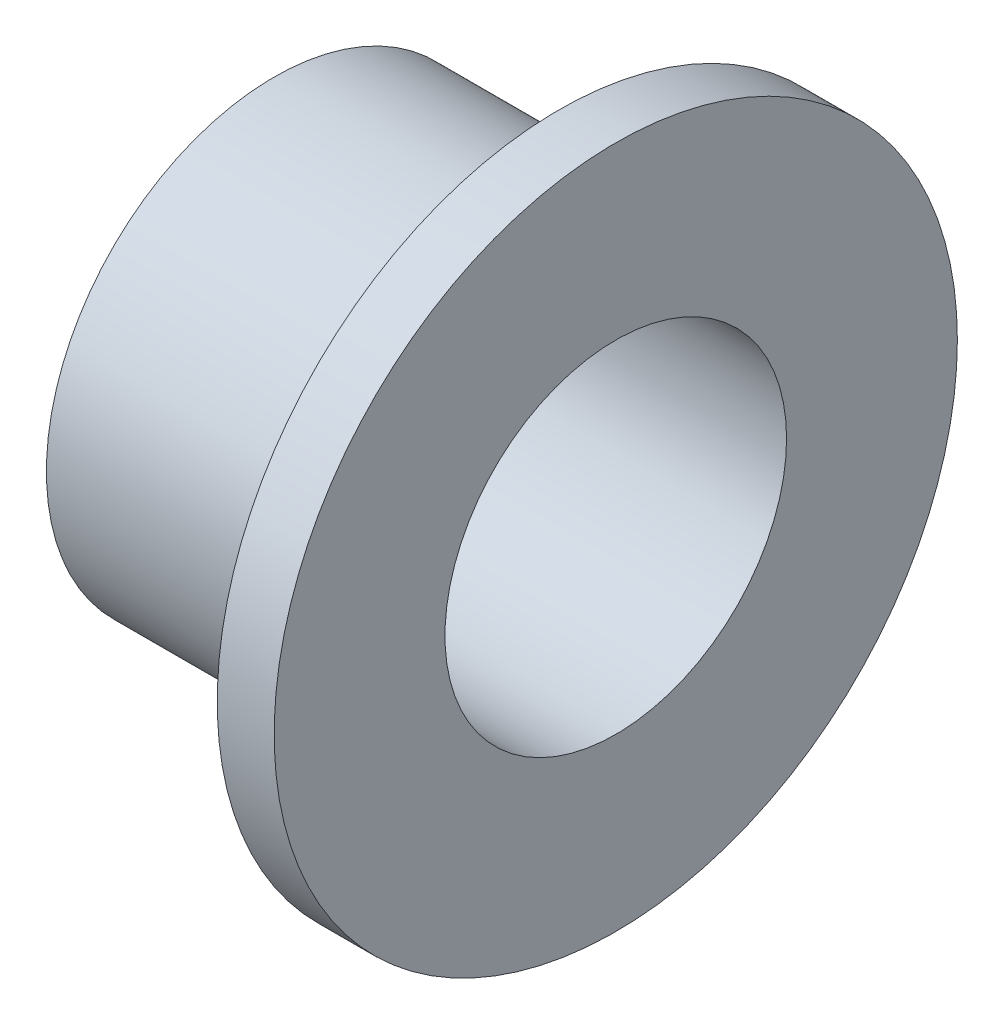
from build123d import *


with BuildPart() as part:
    # Croquis1 → Revolución1 (revolve)
    with BuildSketch(Plane(origin=(0, 0, 0), x_dir=(-1, 0, 0), z_dir=(0, 1, 0)), mode=Mode.PRIVATE) as revoluci_n1_sk:
        Polygon((0, 6), (0, 3), (6, 3), (6, 4), (1, 4), (1, 6), align=None)
    revolve(revoluci_n1_sk.sketch.rotate(Axis((0, 0, 0), (-1, 0, 0)), 180), axis=Axis((0, 0, 0), (-1, 0, 0)))


solid = part.part
